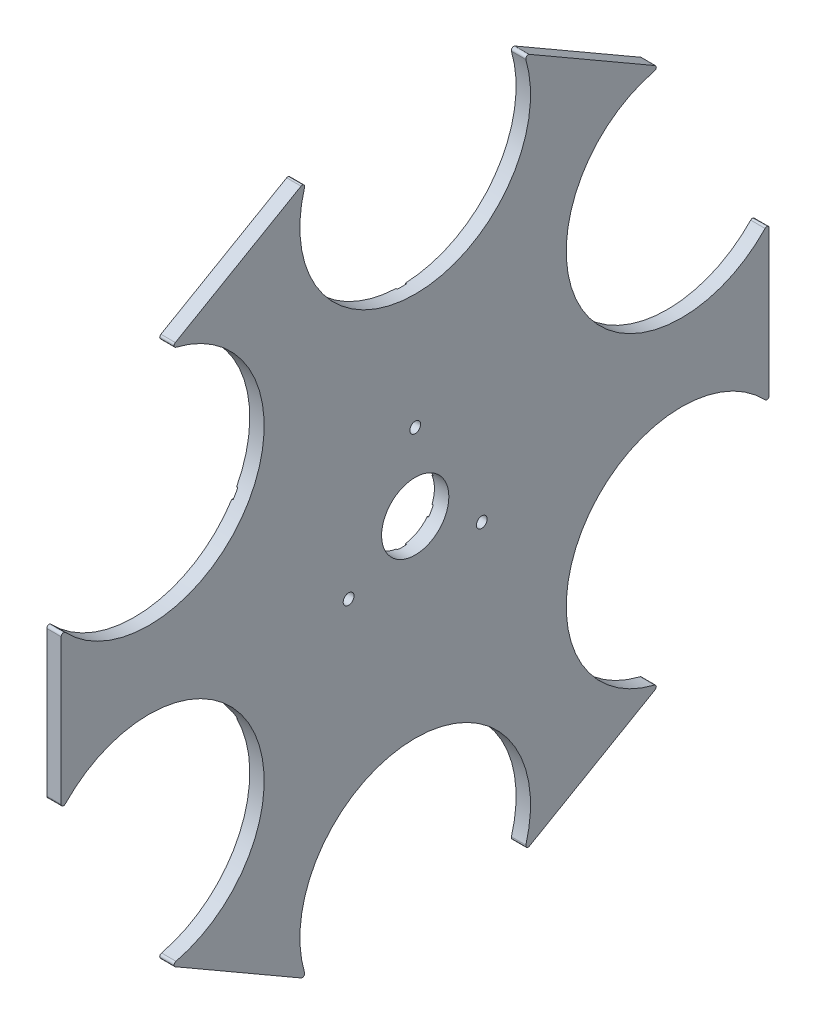
from build123d import *

# Parameters (mm, degrees)
SKETCH2_R                       = 11.10996
BOSS_EXTRUDE1_DEPTH             = 4.7625
SKETCH3_W                       = 3.175
SKETCH3_H                       = 181.991160274
CUT_EXTRUDE1_DEPTH              = 0.396875
FILLET1_R                       = 0.79375
F_9_64_0_14063_DIAMETER_HOLE1_D = 3.572002


with BuildPart() as part:
    # Sketch2 → Boss-Extrude1 (new body)
    with BuildSketch(Plane(origin=(0, 0, 0), x_dir=(0, 0, -1), z_dir=(1, 0, 0))):
        with BuildLine():
            Line((81.02619141, 88.258519733), (35.921024484, 114.3))
            ThreePointArc((35.921024484, 114.3), (0, 63.5), (-35.921024484, 114.3))
            Line((-35.921024484, 114.3), (-81.02619141, 88.258519733))
            ThreePointArc((-81.02619141, 88.258519733), (-54.99261314, 31.75), (-116.947215895, 26.041480267))
            Line((-116.947215895, 26.041480267), (-116.947215895, -26.041480267))
            ThreePointArc((-116.947215895, -26.041480267), (-54.99261314, -31.75), (-81.02619141, -88.258519733))
            Line((-81.02619141, -88.258519733), (-35.921024484, -114.3))
            ThreePointArc((-35.921024484, -114.3), (0, -63.5), (35.921024484, -114.3))
            Line((35.921024484, -114.3), (81.02619141, -88.258519733))
            ThreePointArc((81.02619141, -88.258519733), (54.99261314, -31.75), (116.947215895, -26.041480267))
            Line((116.947215895, -26.041480267), (116.947215895, 26.041480267))
            ThreePointArc((116.947215895, 26.041480267), (54.99261314, 31.75), (81.02619141, 88.258519733))
        make_face()
        with Locations(Location((0, 0, 0), (0, 0, 180))):
            Circle(SKETCH2_R, mode=Mode.SUBTRACT)
    extrude(amount=BOSS_EXTRUDE1_DEPTH)

    # Sketch3 → Cut-Extrude1 (cut)
    with BuildSketch(Plane.ZY):
        with Locations((0, 101.6)):
            Rectangle(SKETCH3_W, SKETCH3_H)
        Polygon((167.586415056, 94.92297474), (165.998915056, 97.672605397), (8.389946993, 6.67702526), (9.977446993, 3.927394603), align=None)
        Polygon((165.998915056, -97.672605397), (167.586415056, -94.92297474), (9.977446993, -3.927394603), (8.389946993, -6.67702526), align=None)
        with Locations((0, -101.6)):
            Rectangle(SKETCH3_W, SKETCH3_H)
        Polygon((-167.586415056, -94.92297474), (-165.998915056, -97.672605397), (-8.389946993, -6.67702526), (-9.977446993, -3.927394603), align=None)
        Polygon((-165.998915056, 97.672605397), (-167.586415056, 94.92297474), (-9.977446993, 3.927394603), (-8.389946993, 6.67702526), align=None)
    extrude(amount=-CUT_EXTRUDE1_DEPTH, mode=Mode.SUBTRACT)

    # Fillet1
    fillet1_edges = [part.edges().sort_by_distance(p)[0] for p in [
        (2.38125, 88.258519733, 81.02619141),
        (2.38125, 114.3, 35.921024484),
        (2.38125, 114.3, -35.921024484),
        (2.38125, 88.258519733, -81.02619141),
        (2.38125, 26.041480267, -116.947215895),
        (2.38125, -26.041480267, -116.947215895),
        (2.38125, -88.258519733, -81.02619141),
        (2.38125, -114.3, -35.921024484),
        (2.38125, -114.3, 35.921024484),
        (2.38125, -88.258519733, 81.02619141),
        (2.38125, -26.041480267, 116.947215895),
        (2.38125, 26.041480267, 116.947215895),
    ]]
    fillet(fillet1_edges, radius=FILLET1_R)

    # 9/64 (0.14063) Diameter Hole1 (through all)
    with Locations(Plane.ZY):
        with Locations((0, 25.4), (21.997045256, -12.7), (-21.997045256, -12.7)):
            Hole(F_9_64_0_14063_DIAMETER_HOLE1_D / 2)


solid = part.part
